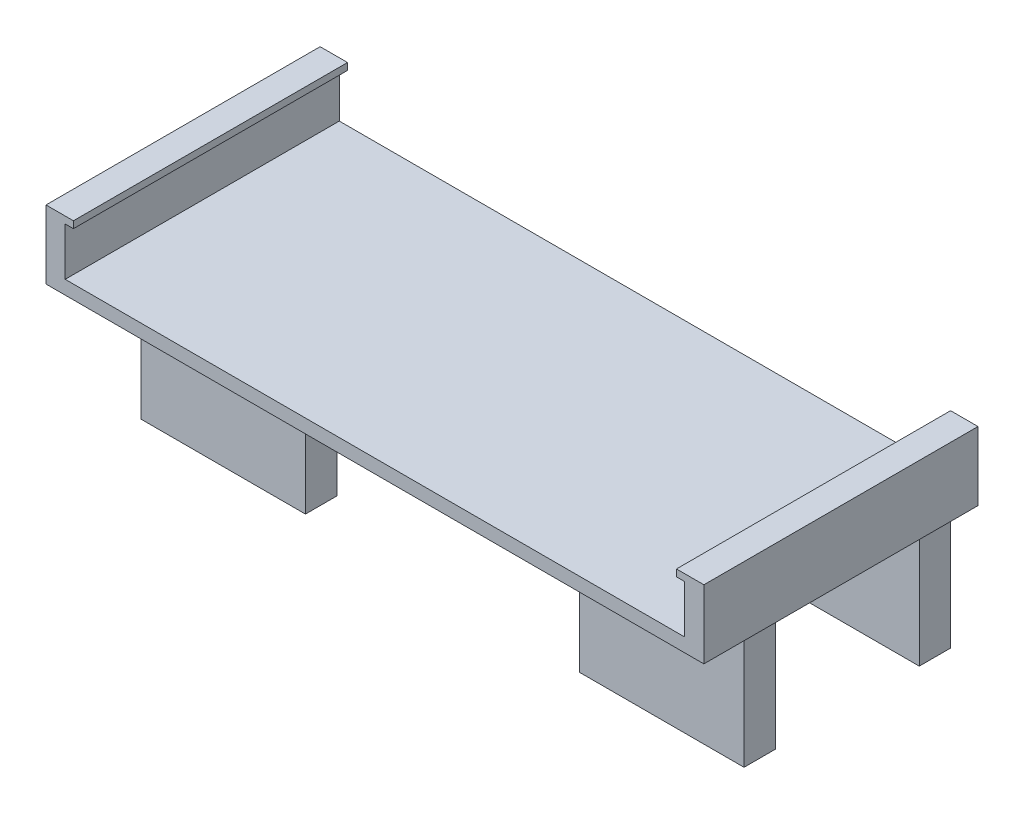
from build123d import *

# Parameters (mm, degrees)
SKETCH_1_W          = 48
SKETCH_1_H          = 20
EXTRUDE_1_DEPTH     = 5
CUT_EXTRUDE_1_DEPTH = 33.234273685
SKETCH_3_W          = 12
SKETCH_3_H          = 15.07
EXTRUDE_2_DEPTH     = 10
SKETCH_4_W          = 10.5
SKETCH_4_H          = 8
CUT_EXTRUDE_2_DEPTH = 50.294132697


with BuildPart() as part:
    # 草图1 → 凸台-拉伸1 (new body)
    with BuildSketch(Plane(origin=(0, 0, 0), x_dir=(1, 0, 0), z_dir=(0, 1, 0))):
        with Locations((-0.78, 4.625714286)):
            Rectangle(SKETCH_1_W, SKETCH_1_H)
    extrude(amount=EXTRUDE_1_DEPTH)

    # 草图2 → 切除-拉伸1 (cut, through all)
    with BuildSketch(Plane.XY.offset(5.374285714)):
        Polygon((-22.78, 5), (-22.78, 4.5), (-23.38, 4.5), (-23.38, 1), (21.82, 1), (21.82, 4.5), (21.22, 4.5), (21.22, 5), align=None)
    extrude(amount=-CUT_EXTRUDE_1_DEPTH, mode=Mode.SUBTRACT)

    # 草图3 → 凸台-拉伸2 (add)
    with BuildSketch(Plane.XZ):
        with Locations((-16.78, -7.090714286)):
            Rectangle(SKETCH_3_W, SKETCH_3_H)
        with Locations((15.22, -7.090714286)):
            Rectangle(SKETCH_3_W, SKETCH_3_H)
    extrude(amount=EXTRUDE_2_DEPTH)

    # 草图4 → 切除-拉伸2 (cut, through all)
    with BuildSketch(Plane(origin=(21.22, 0, 0), x_dir=(0, 0, -1), z_dir=(1, 0, 0))):
        with Locations((7.090714286, -6)):
            Rectangle(SKETCH_4_W, SKETCH_4_H)
    extrude(amount=-CUT_EXTRUDE_2_DEPTH, mode=Mode.SUBTRACT)


solid = part.part
